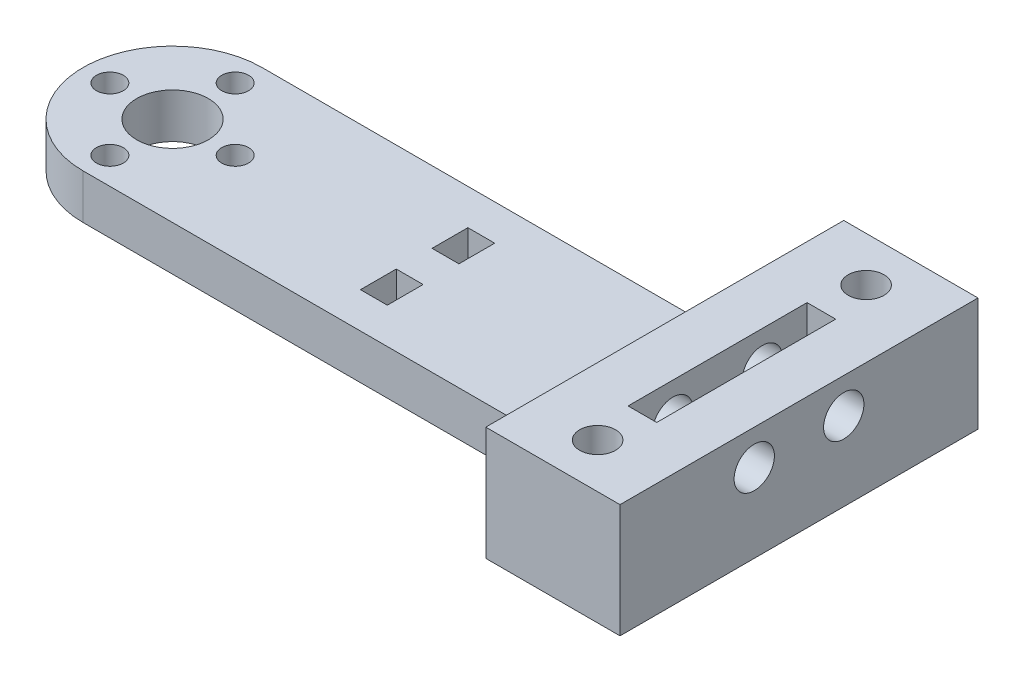
from build123d import *

# Parameters (mm, degrees)
EXTRUDE_1_DEPTH     = 5
SKETCH_2_R          = 1.5
SKETCH_2_R_2        = 4
CUT_EXTRUDE_1_DEPTH = 5
SKETCH_3_W          = 3
SKETCH_3_H          = 4
CUT_EXTRUDE_2_DEPTH = 5
SKETCH_4_R          = 4
SKETCH_4_R_2        = 1.1
SKETCH_4_W          = 3
SKETCH_4_H          = 4
CUT_EXTRUDE_4_DEPTH = 10
SKETCH_5_W          = 50
SKETCH_5_H          = 20
CUT_EXTRUDE_5_DEPTH = 10
SKETCH_6_W          = 15
SKETCH_6_H          = 20
EXTRUDE_2_DEPTH     = 7.7
SKETCH_7_R          = 2.25
CUT_EXTRUDE_6_DEPTH = 20
SKETCH_8_W          = 15
SKETCH_8_H          = 10
SKETCH_8_R          = 2
EXTRUDE_3_DEPTH     = 12.7
SKETCH_9_W          = 3.2
SKETCH_9_H          = 20
CUT_EXTRUDE_7_DEPTH = 8


with BuildPart() as part:
    # 草图1 → 凸台-拉伸1 (new body)
    with BuildSketch(Plane(origin=(0, 0, 0), x_dir=(1, 0, 0), z_dir=(0, 1, 0))):
        with BuildLine():
            Line((-41.199983302, 20), (78.800016698, 20))
            Line((78.800016698, 20), (78.800016698, 0))
            Line((78.800016698, 0), (-41.199983302, 0))
            ThreePointArc((-41.199983302, 0), (-51.199983302, 10), (-41.199983302, 20))
        make_face()
    extrude(amount=EXTRUDE_1_DEPTH)

    # 草图2 → 切除-拉伸1 (cut)
    with BuildSketch(Plane(origin=(0, 5, 0), x_dir=(1, 0, 0), z_dir=(0, 1, 0))):
        with Locations(Location((-48.199983302, 10, 0), (0, 0, 270))):
            Circle(SKETCH_2_R)
        with BuildLine():
            ThreePointArc((-39.699983302, 17), (-40.13932313, 18.060660172), (-41.199983302, 18.5))
            Line((-41.199983302, 18.5), (-41.199983302, 17))
            Line((-41.199983302, 17), (-41.199983302, 15.5))
            ThreePointArc((-41.199983302, 15.5), (-40.13932313, 15.939339828), (-39.699983302, 17))
        make_face()
        with BuildLine():
            Line((-41.199983302, 17), (-41.199983302, 18.5))
            ThreePointArc((-41.199983302, 18.5), (-42.699983302, 17), (-41.199983302, 15.5))
            Line((-41.199983302, 15.5), (-41.199983302, 17))
        make_face()
        with Locations(Location((-34.199983302, 10, 0), (0, 0, 270))):
            Circle(SKETCH_2_R)
        with BuildLine():
            ThreePointArc((-39.699983302, 3), (-40.13932313, 4.060660172), (-41.199983302, 4.5))
            Line((-41.199983302, 4.5), (-41.199983302, 3))
            Line((-41.199983302, 3), (-41.199983302, 1.5))
            ThreePointArc((-41.199983302, 1.5), (-40.13932313, 1.939339828), (-39.699983302, 3))
        make_face()
        with BuildLine():
            Line((-41.199983302, 3), (-41.199983302, 4.5))
            ThreePointArc((-41.199983302, 4.5), (-42.699983302, 3), (-41.199983302, 1.5))
            Line((-41.199983302, 1.5), (-41.199983302, 3))
        make_face()
        with Locations(Location((-41.199983302, 10, 0), (0, 0, 270))):
            Circle(SKETCH_2_R_2)
    extrude(amount=-CUT_EXTRUDE_1_DEPTH, mode=Mode.SUBTRACT)

    # 草图3 → 切除-拉伸2 (cut)
    with BuildSketch(Plane(origin=(0, 5, 0), x_dir=(1, 0, 0), z_dir=(0, 1, 0))):
        with Locations((-12.699983302, 14)):
            Rectangle(SKETCH_3_W, SKETCH_3_H)
        with Locations((-12.699983302, 6)):
            Rectangle(SKETCH_3_W, SKETCH_3_H)
    extrude(amount=-CUT_EXTRUDE_2_DEPTH, mode=Mode.SUBTRACT)

    # 草图4 → 切除-拉伸4 (cut)
    with BuildSketch(Plane(origin=(0, 5, 0), x_dir=(1, 0, 0), z_dir=(0, 1, 0))):
        with Locations(Location((69.300016698, 10, 0), (0, 0, 270))):
            Circle(SKETCH_4_R)
        with Locations(Location((76.7246379, 17.424621202, 0), (0, 0, 270))):
            Circle(SKETCH_4_R_2)
        with Locations(Location((62.300016698, 10, 0), (0, 0, 270))):
            Circle(SKETCH_4_R_2)
        with Locations((50.800016698, 6)):
            Rectangle(SKETCH_4_W, SKETCH_4_H)
        with Locations((50.800016698, 14)):
            Rectangle(SKETCH_4_W, SKETCH_4_H)
        with Locations(Location((76.7246379, 2.575378798, 0), (0, 0, 270))):
            Circle(SKETCH_4_R_2)
        with Locations(Location((61.875395496, 2.575378798, 0), (0, 0, 270))):
            Circle(SKETCH_4_R_2)
        with Locations(Location((61.875395496, 17.424621202, 0), (0, 0, 270))):
            Circle(SKETCH_4_R_2)
        with Locations(Location((69.300016698, 17, 0), (0, 0, 270))):
            Circle(SKETCH_4_R_2)
        with Locations(Location((76.300016698, 10, 0), (0, 0, 270))):
            Circle(SKETCH_4_R_2)
        with Locations(Location((69.300016698, 3, 0), (0, 0, 270))):
            Circle(SKETCH_4_R_2)
    extrude(amount=-CUT_EXTRUDE_4_DEPTH, mode=Mode.SUBTRACT)

    # 草图5 → 切除-拉伸5 (cut)
    with BuildSketch(Plane(origin=(0, 5, 0), x_dir=(1, 0, 0), z_dir=(0, 1, 0))):
        with Locations((53.800016698, 10)):
            Rectangle(SKETCH_5_W, SKETCH_5_H)
    extrude(amount=-CUT_EXTRUDE_5_DEPTH, mode=Mode.SUBTRACT)

    # 草图6 → 凸台-拉伸2 (add)
    with BuildSketch(Plane(origin=(0, 5, 0), x_dir=(1, 0, 0), z_dir=(0, 1, 0))):
        with Locations((21.300016698, 10)):
            Rectangle(SKETCH_6_W, SKETCH_6_H)
    extrude(amount=EXTRUDE_2_DEPTH)

    # 草图7 → 切除-拉伸6 (cut)
    with BuildSketch(Plane(origin=(28.800016698, 0, 0), x_dir=(0, 0, -1), z_dir=(1, 0, 0))):
        with Locations((5, 8.8)):
            Circle(SKETCH_7_R)
        with Locations((15, 8.8)):
            Circle(SKETCH_7_R)
    extrude(amount=-CUT_EXTRUDE_6_DEPTH, mode=Mode.SUBTRACT)

    # 草图8 → 凸台-拉伸3 (add)
    # profile 1 of 2: a face of its own
    with BuildSketch(Plane(origin=(0, 12.7, 0), x_dir=(1, 0, 0), z_dir=(0, 1, 0))):
        with Locations((21.300016698, 25)):
            Rectangle(SKETCH_8_W, SKETCH_8_H)
        with Locations(Location((21.300016698, 25, 0), (0, 0, 270))):
            Circle(SKETCH_8_R, mode=Mode.SUBTRACT)
    # profile 2 of 2: a face of its own
    with BuildSketch(Plane(origin=(0, 12.7, 0), x_dir=(1, 0, 0), z_dir=(0, 1, 0))):
        with Locations((21.300016698, -5)):
            Rectangle(SKETCH_8_W, SKETCH_8_H)
        with Locations(Location((21.300016698, -5, 0), (0, 0, 270))):
            Circle(SKETCH_8_R, mode=Mode.SUBTRACT)
    extrude(amount=-EXTRUDE_3_DEPTH)

    # 草图9 → 切除-拉伸7 (cut)
    with BuildSketch(Plane(origin=(0, 12.7, 0), x_dir=(1, 0, 0), z_dir=(0, 1, 0))):
        with Locations((21.300016698, 10)):
            Rectangle(SKETCH_9_W, SKETCH_9_H)
    extrude(amount=-CUT_EXTRUDE_7_DEPTH, mode=Mode.SUBTRACT)


solid = part.part
